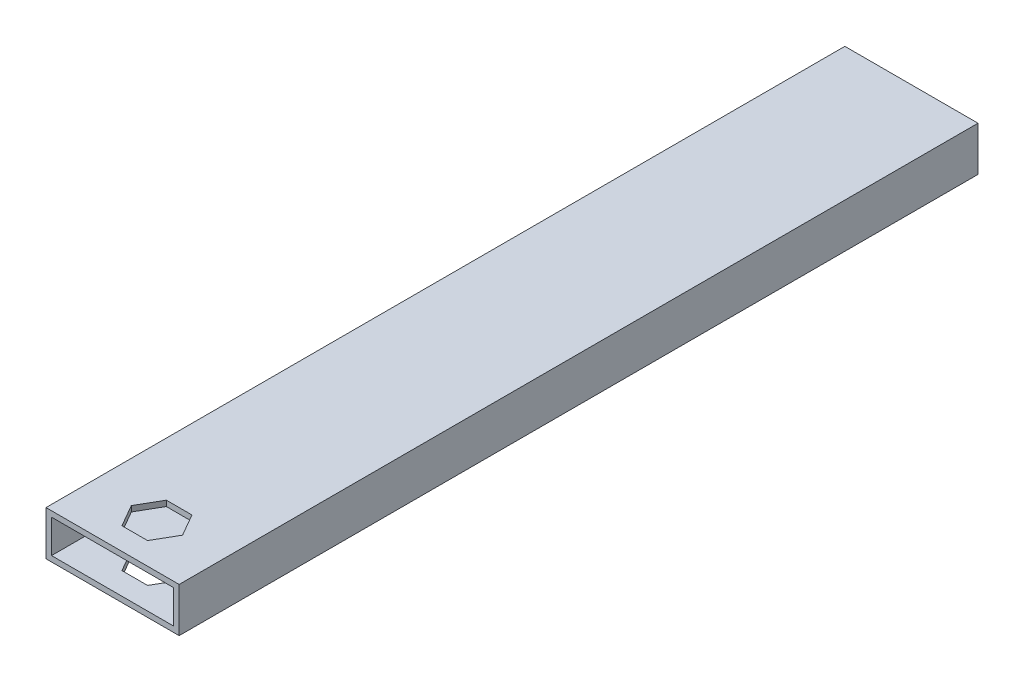
from build123d import *

# Parameters (mm, degrees)
SKETCH1_W           = 38.1
SKETCH1_H           = 12.7
BOSS_EXTRUDE1_DEPTH = 228.6
SKETCH2_W           = 34.925
SKETCH2_H           = 9.525
CUT_EXTRUDE1_DEPTH  = 233.100969408
CUT_EXTRUDE2_DEPTH  = 233.100969408


with BuildPart() as part:
    # Sketch1 → Boss-Extrude1 (new body)
    with BuildSketch(Plane.XY):
        with Locations((19.05, 6.35)):
            Rectangle(SKETCH1_W, SKETCH1_H)
    extrude(amount=BOSS_EXTRUDE1_DEPTH)

    # Sketch2 → Cut-Extrude1 (cut, through all)
    with BuildSketch(Plane.XY.offset(228.6)):
        with Locations((19.05, 6.35)):
            Rectangle(SKETCH2_W, SKETCH2_H)
    extrude(amount=-CUT_EXTRUDE1_DEPTH, mode=Mode.SUBTRACT)

    # Sketch3 → Cut-Extrude2 (cut, through all)
    with BuildSketch(Plane.XZ):
        Polygon((26.382348419, 215.9), (22.716174209, 222.25), (15.383825791, 222.25), (11.717651581, 215.9), (15.383825791, 209.55), (22.716174209, 209.55), align=None)
    extrude(amount=-CUT_EXTRUDE2_DEPTH, mode=Mode.SUBTRACT)


solid = part.part
